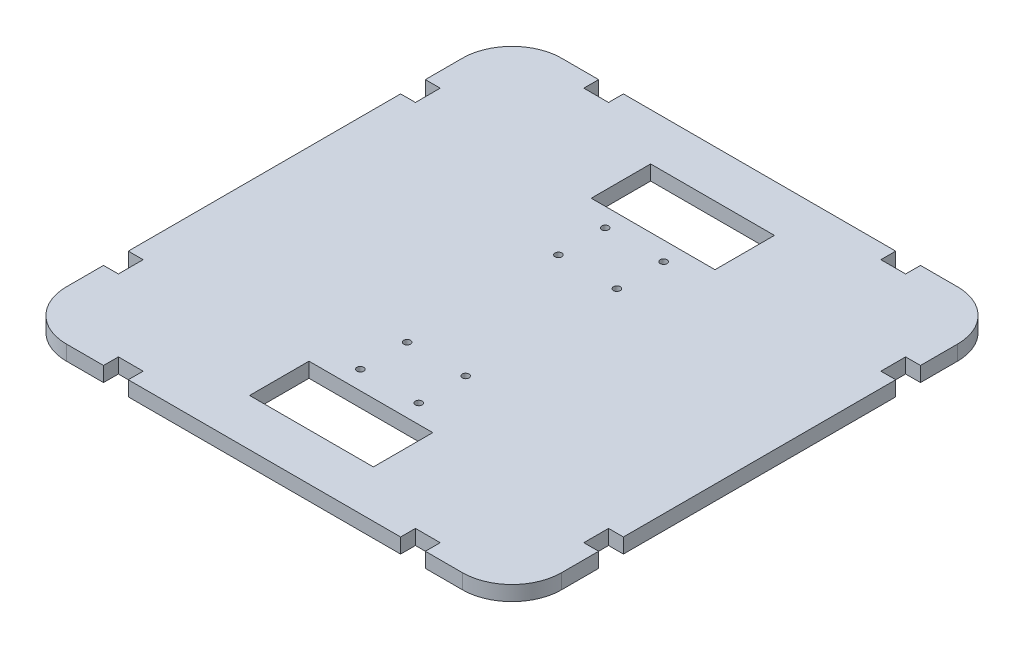
from build123d import *

# Parameters (mm, degrees)
SKETCH1_W               = 254
SKETCH1_H               = 254
PLATFORM_BASE_DEPTH     = 7.62
CORNER_ROUNDING_R       = 25.4
SKETCH3_R               = 1.75
CUT_EXTRUDE1_DEPTH      = 180.766694357
SKETCH4_W               = 63.5
SKETCH4_H               = 30.48
CUT_EXTRUDE2_DEPTH      = 180.766694357
SKETCH6_W               = 12.7
SKETCH6_H               = 7.62
CUT_EXTRUDE3_DEPTH      = 180.766694357
MIRROR5_COPY_1_SKETCH_W = 12.7
MIRROR5_COPY_1_SKETCH_H = 7.62
MIRROR5_COPY_1_DEPTH    = 180.766694357
MIRROR5_COPY_2_SKETCH_W = 12.7
MIRROR5_COPY_2_SKETCH_H = 7.62
MIRROR5_COPY_2_DEPTH    = 180.766694357
SKETCH8_W               = 7.62
SKETCH8_H               = 12.7
CUT_EXTRUDE4_DEPTH      = 180.766694357
MIRROR7_COPY_1_SKETCH_W = 7.62
MIRROR7_COPY_1_SKETCH_H = 12.7
MIRROR7_COPY_1_DEPTH    = 180.766694357
MIRROR7_COPY_2_SKETCH_W = 7.62
MIRROR7_COPY_2_SKETCH_H = 12.7
MIRROR7_COPY_2_DEPTH    = 180.766694357


with BuildPart() as part:
    # Sketch1 → Platform-Base (new body)
    with BuildSketch(Plane(origin=(0, 0, 0), x_dir=(1, 0, 0), z_dir=(0, 1, 0))):
        Rectangle(SKETCH1_W, SKETCH1_H)
    extrude(amount=PLATFORM_BASE_DEPTH)

    # Corner-Rounding
    corner_rounding_edges = [part.edges().sort_by_distance(p)[0] for p in [
        (-127, 3.81, -127),
        (127, 3.81, -127),
        (127, 3.81, 127),
        (-127, 3.81, 127),
    ]]
    fillet(corner_rounding_edges, radius=CORNER_ROUNDING_R)

    # Sketch3 → Cut-Extrude1 (cut, through all)
    with BuildSketch(Plane(origin=(0, 7.62, 0), x_dir=(1, 0, 0), z_dir=(0, 1, 0))):
        with Locations((15, -38.8)):
            Circle(SKETCH3_R)
        with Locations((15, -62.8)):
            Circle(SKETCH3_R)
        with Locations((-15, -62.8)):
            Circle(SKETCH3_R)
        with Locations((-15, -38.8)):
            Circle(SKETCH3_R)
    cut_extrude1 = extrude(amount=-CUT_EXTRUDE1_DEPTH, mode=Mode.SUBTRACT)

    # Mirror2: Cut-Extrude1 across plane
    add(cut_extrude1.mirror(Plane.XY), mode=Mode.SUBTRACT)

    # Sketch4 → Cut-Extrude2 (cut, through all)
    with BuildSketch(Plane(origin=(0, 7.62, 0), x_dir=(1, 0, 0), z_dir=(0, 1, 0))):
        with Locations((0, -87.63)):
            Rectangle(SKETCH4_W, SKETCH4_H)
    cut_extrude2 = extrude(amount=-CUT_EXTRUDE2_DEPTH, mode=Mode.SUBTRACT)

    # Mirror3: Cut-Extrude2 across plane
    add(cut_extrude2.mirror(Plane.XY), mode=Mode.SUBTRACT)

    # Sketch6 → Cut-Extrude3 (cut, through all)
    with BuildSketch(Plane(origin=(0, 7.62, 0), x_dir=(1, 0, 0), z_dir=(0, 1, 0))):
        with Locations((-76.2, -123.19)):
            Rectangle(SKETCH6_W, SKETCH6_H)
    cut_extrude3 = extrude(amount=-CUT_EXTRUDE3_DEPTH, mode=Mode.SUBTRACT)

    # Mirror4: Cut-Extrude3 across plane
    add(cut_extrude3.mirror(Plane.XY), mode=Mode.SUBTRACT)

    # Mirror5 copy 1 sketch → Mirror5 copy 1 (cut, through all)
    with BuildSketch(Plane(origin=(0, 7.62, 0), x_dir=(-1, 0, 0), z_dir=(0, 1, 0))):
        with Locations((-76.2, -123.19)):
            Rectangle(MIRROR5_COPY_1_SKETCH_W, MIRROR5_COPY_1_SKETCH_H)
    extrude(amount=-MIRROR5_COPY_1_DEPTH, mode=Mode.SUBTRACT)

    # Mirror5 copy 2 sketch → Mirror5 copy 2 (cut, through all)
    with BuildSketch(Plane(origin=(0, 7.62, 0), x_dir=(-1, 0, 0), z_dir=(0, 1, 0))):
        with Locations((-76.2, 123.19)):
            Rectangle(MIRROR5_COPY_2_SKETCH_W, MIRROR5_COPY_2_SKETCH_H)
    extrude(amount=-MIRROR5_COPY_2_DEPTH, mode=Mode.SUBTRACT)

    # Sketch8 → Cut-Extrude4 (cut, through all)
    with BuildSketch(Plane(origin=(0, 7.62, 0), x_dir=(1, 0, 0), z_dir=(0, 1, 0))):
        with Locations((-123.19, -76.2)):
            Rectangle(SKETCH8_W, SKETCH8_H)
    cut_extrude4 = extrude(amount=-CUT_EXTRUDE4_DEPTH, mode=Mode.SUBTRACT)

    # Mirror6: Cut-Extrude4 across plane
    add(cut_extrude4.mirror(Plane.XY), mode=Mode.SUBTRACT)

    # Mirror7 copy 1 sketch → Mirror7 copy 1 (cut, through all)
    with BuildSketch(Plane(origin=(0, 7.62, 0), x_dir=(-1, 0, 0), z_dir=(0, 1, 0))):
        with Locations((-123.19, -76.2)):
            Rectangle(MIRROR7_COPY_1_SKETCH_W, MIRROR7_COPY_1_SKETCH_H)
    extrude(amount=-MIRROR7_COPY_1_DEPTH, mode=Mode.SUBTRACT)

    # Mirror7 copy 2 sketch → Mirror7 copy 2 (cut, through all)
    with BuildSketch(Plane(origin=(0, 7.62, 0), x_dir=(-1, 0, 0), z_dir=(0, 1, 0))):
        with Locations((-123.19, 76.2)):
            Rectangle(MIRROR7_COPY_2_SKETCH_W, MIRROR7_COPY_2_SKETCH_H)
    extrude(amount=-MIRROR7_COPY_2_DEPTH, mode=Mode.SUBTRACT)


solid = part.part
